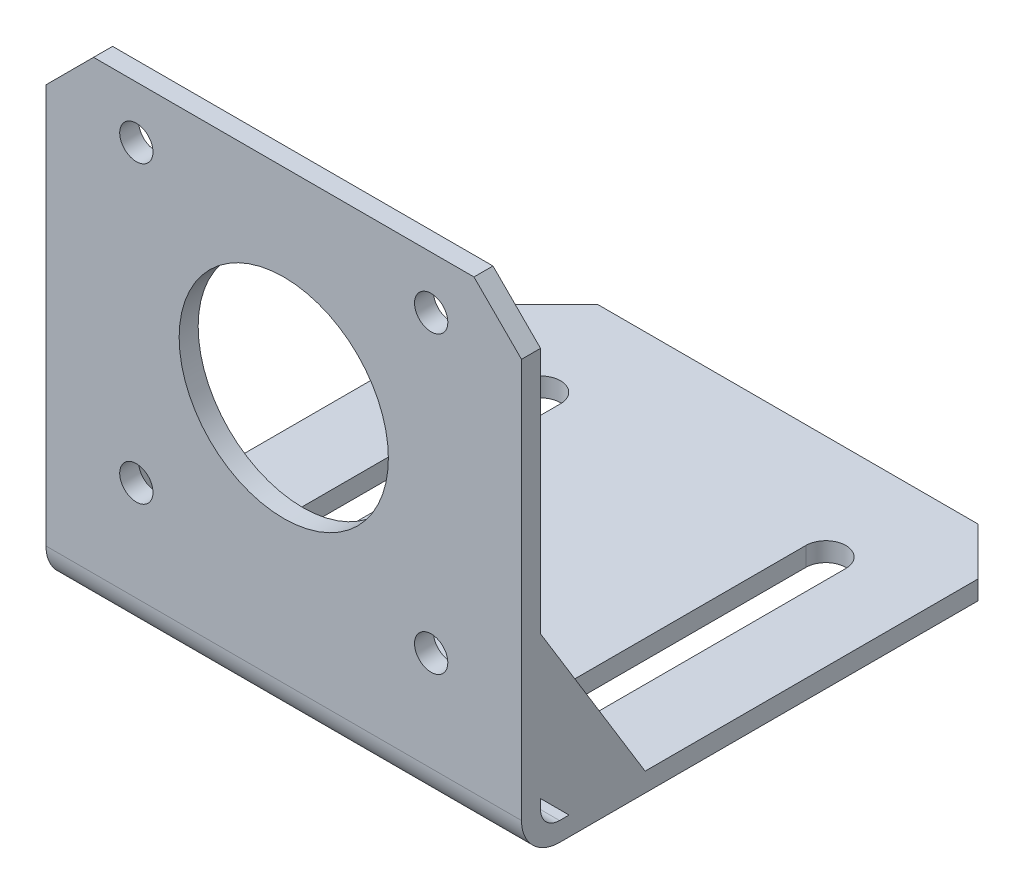
from build123d import *

# Parameters (mm, degrees)
BOSS_EXTRUDE1_DEPTH = 50
BOSS_EXTRUDE2_DEPTH = 2
BOSS_EXTRUDE3_DEPTH = 2
SKETCH4_R           = 11
SKETCH4_R_2         = 1.75
CUT_EXTRUDE1_DEPTH  = 5
CUT_EXTRUDE2_DEPTH  = 5
CHAMFER1_SIZE       = 5


with BuildPart() as part:
    # Sketch1 → Boss-Extrude1 (new body)
    with BuildSketch(Plane(origin=(0, 0, 0), x_dir=(0, 0, -1), z_dir=(1, 0, 0))):
        with BuildLine():
            Line((0, 51), (0, 4))
            ThreePointArc((0, 4), (1.171572875, 1.171572875), (4, 0))
            Line((4, 0), (53, 0))
            Line((53, 0), (53, 2))
            Line((53, 2), (4, 2))
            ThreePointArc((4, 2), (2.585786438, 2.585786438), (2, 4))
            Line((2, 4), (2, 51))
            Line((2, 51), (0, 51))
        make_face()
    extrude(amount=-BOSS_EXTRUDE1_DEPTH)

    # Sketch2 → Boss-Extrude2 (add)
    with BuildSketch(Plane(origin=(0, 0, 0), x_dir=(0, 0, -1), z_dir=(1, 0, 0))):
        Polygon((2, 20), (13, 2), (5, 2), (2, 5), align=None)
    extrude(amount=-BOSS_EXTRUDE2_DEPTH)

    # Sketch3 → Boss-Extrude3 (add)
    with BuildSketch(Plane.ZY.offset(50)):
        Polygon((-2, 20), (-13, 2), (-5, 2), (-2, 5), align=None)
    extrude(amount=-BOSS_EXTRUDE3_DEPTH)

    # Sketch4 → Cut-Extrude1 (cut)
    with BuildSketch(Plane.XY):
        with Locations((-25, 30)):
            Circle(SKETCH4_R)
        with Locations((-9.5, 45.5)):
            Circle(SKETCH4_R_2)
        with Locations((-40.5, 45.5)):
            Circle(SKETCH4_R_2)
        with Locations((-40.5, 14.5)):
            Circle(SKETCH4_R_2)
        with Locations((-9.5, 14.5)):
            Circle(SKETCH4_R_2)
    extrude(amount=-CUT_EXTRUDE1_DEPTH, mode=Mode.SUBTRACT)

    # Sketch5 → Cut-Extrude2 (cut)
    with BuildSketch(Plane.XZ):
        with BuildLine():
            Line((-7.9, -42), (-7.9, -12))
            ThreePointArc((-7.9, -12), (-10, -9.9), (-12.1, -12))
            Line((-12.1, -12), (-12.1, -42))
            ThreePointArc((-12.1, -42), (-10, -44.1), (-7.9, -42))
        make_face()
        with BuildLine():
            Line((-37.9, -42), (-37.9, -12))
            ThreePointArc((-37.9, -12), (-40, -9.9), (-42.1, -12))
            Line((-42.1, -12), (-42.1, -42))
            ThreePointArc((-42.1, -42), (-40, -44.1), (-37.9, -42))
        make_face()
    extrude(amount=-CUT_EXTRUDE2_DEPTH, mode=Mode.SUBTRACT)

    # Chamfer1
    chamfer1_edges = [part.edges().sort_by_distance(p)[0] for p in [
        (0, 51, -1),
        (-50, 1, -53),
        (-50, 51, -1),
        (0, 1, -53),
    ]]
    chamfer(chamfer1_edges, length=CHAMFER1_SIZE)


solid = part.part
